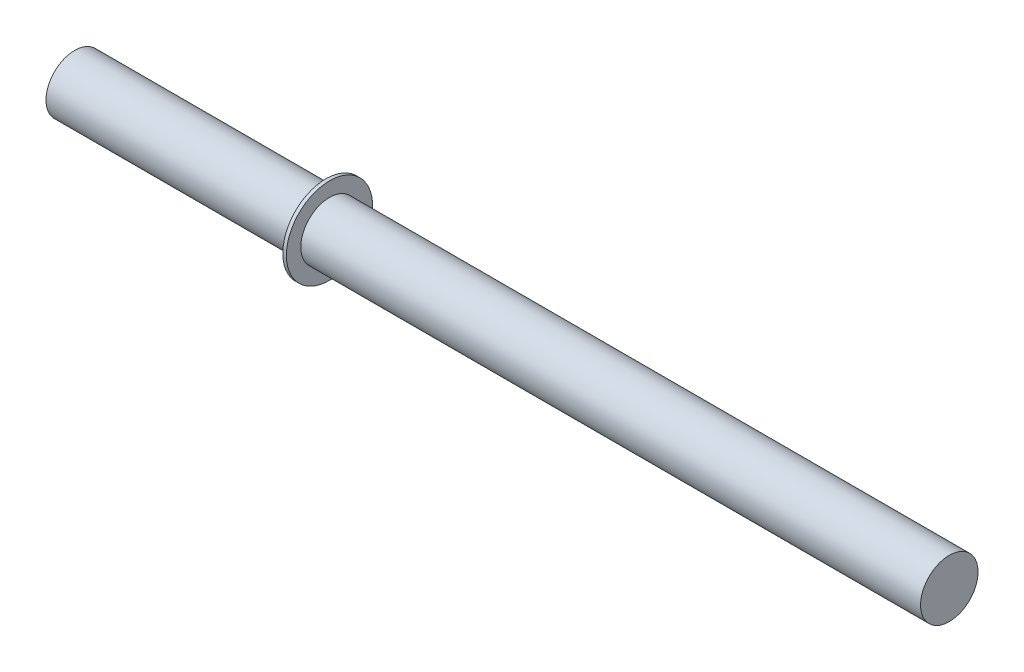
from build123d import *

# Parameters (mm, degrees)
ESBO_O1_W = 121.7
ESBO_O1_H = 4
ESBO_O2_W = 0.5
ESBO_O2_H = 6


with BuildPart() as part:
    # Esboço1 → Revolução2 (revolve)
    with BuildSketch(Plane.XY, mode=Mode.PRIVATE) as revolu_o2_sk:
        with Locations((0, -2)):
            Rectangle(ESBO_O1_W, ESBO_O1_H)
    revolve(revolu_o2_sk.sketch.rotate(Axis((-60.85, 0, 0), (1, 0, 0)), 270), axis=Axis((-60.85, 0, 0), (1, 0, 0)))

    # Esboço2 → Revolução3 (revolve)
    with BuildSketch(Plane.XY, mode=Mode.PRIVATE) as revolu_o3_sk:
        with Locations((-25.65, -3)):
            Rectangle(ESBO_O2_W, ESBO_O2_H)
    revolve(revolu_o3_sk.sketch.rotate(Axis((-25.9, 0, 0), (1, 0, 0)), 270), axis=Axis((-25.9, 0, 0), (1, 0, 0)))


solid = part.part
